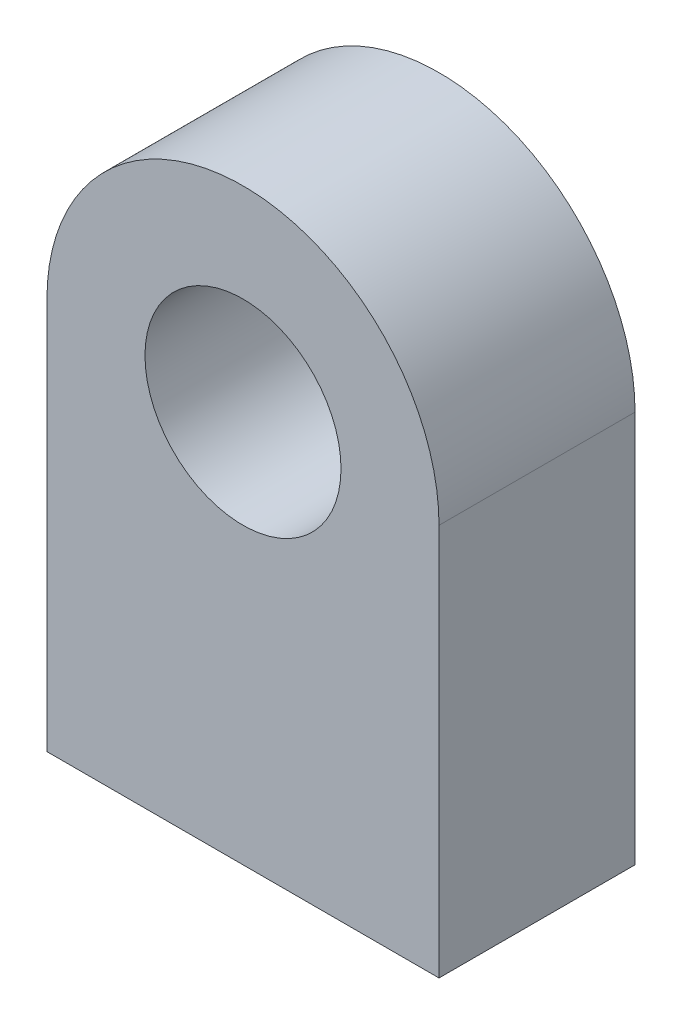
from build123d import *

# Parameters (mm, degrees)
SKETCH1_R           = 3.175
BOSS_EXTRUDE1_DEPTH = 6.35


with BuildPart() as part:
    # Sketch1 → Boss-Extrude1 (new body)
    with BuildSketch(Plane.XY):
        with BuildLine():
            Line((-6.35, 0), (-6.35, -12.7))
            Line((-6.35, -12.7), (6.35, -12.7))
            Line((6.35, -12.7), (6.35, 0))
            ThreePointArc((6.35, 0), (0, 6.35), (-6.35, 0))
        make_face()
        Circle(SKETCH1_R, mode=Mode.SUBTRACT)
    extrude(amount=BOSS_EXTRUDE1_DEPTH)


solid = part.part
